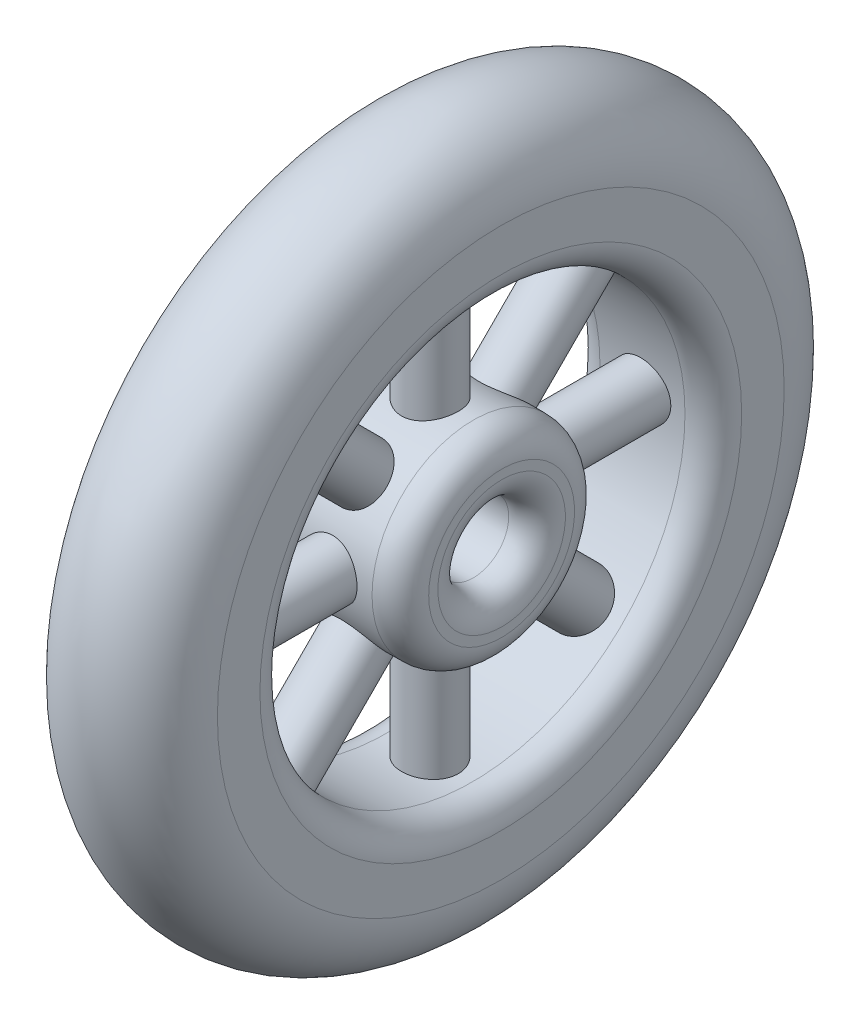
from build123d import *

# Parameters (mm, degrees)
SWEEP1_PROFILE_R  = 1.27
CIRPATTERN1_COUNT = 8
SCALE2_SCALE      = 1.15


with BuildPart() as part:
    # Sketch3 → Revolve1 (revolve)
    with BuildSketch(Plane.XY, mode=Mode.PRIVATE) as revolve1_sk:
        with BuildLine():
            Line((-1.942226168, 1.5875), (1.942226168, 1.5875))
            ThreePointArc((1.942226168, 1.5875), (2.84025178, 1.959474388), (3.212226168, 2.8575))
            Line((3.212226168, 2.8575), (3.212226168, 3.268158252))
            ThreePointArc((3.212226168, 3.268158252), (2.84025178, 4.166183864), (1.942226168, 4.538158252))
            Line((1.942226168, 4.538158252), (-1.942226168, 4.538158252))
            ThreePointArc((-1.942226168, 4.538158252), (-2.84025178, 4.166183864), (-3.212226168, 3.268158252))
            Line((-3.212226168, 3.268158252), (-3.212226168, 2.8575))
            ThreePointArc((-3.212226168, 2.8575), (-2.84025178, 1.959474388), (-1.942226168, 1.5875))
        make_face()
        with BuildLine():
            Line((-3.175, 12.7), (-3.175, 10.795))
            ThreePointArc((-3.175, 10.795), (-2.803025612, 9.896974388), (-1.905, 9.525))
            Line((-1.905, 9.525), (1.905, 9.525))
            ThreePointArc((1.905, 9.525), (2.803025612, 9.896974388), (3.175, 10.795))
            Line((3.175, 10.795), (3.175, 12.7))
            ThreePointArc((3.175, 12.7), (0, 15.875), (-3.175, 12.7))
        make_face()
    revolve(revolve1_sk.sketch.rotate(Axis((-11.977214198, 0, 0), (1, 0, 0)), 90), axis=Axis((-11.977214198, 0, 0), (1, 0, 0)))

    # Sweep1: sweep along a path in Sketch5
    with BuildLine(Plane(origin=(0, 0, 0), x_dir=(0, 0, -1), z_dir=(1, 0, 0))) as sweep1_path:
        Line((0, 3.062829126), (0, 12.7))
    # Sweep1 profile (on start of the path) → Sweep1 (sweep)
    with BuildSketch(Plane.ZX.offset(3.062829126)):
        Circle(SWEEP1_PROFILE_R)
    sweep1 = sweep(path=sweep1_path.line)

    # CirPattern1: Sweep1 ×8 about axis
    cirpattern1_axis = Axis((-11.977214198, 0, 0), (1, 0, 0))
    for i in range(1, CIRPATTERN1_COUNT):
        add(sweep1.rotate(cirpattern1_axis, i * 360 / CIRPATTERN1_COUNT))


with BuildPart() as part_1:
    # Scale2: scaled about (2.0691e-05, -5.4388e-05, -1.1572e-05)
    add(part.part.scale(SCALE2_SCALE).moved(Location((-3.104e-06, 8.158e-06, 1.736e-06))))


solid = part_1.part
